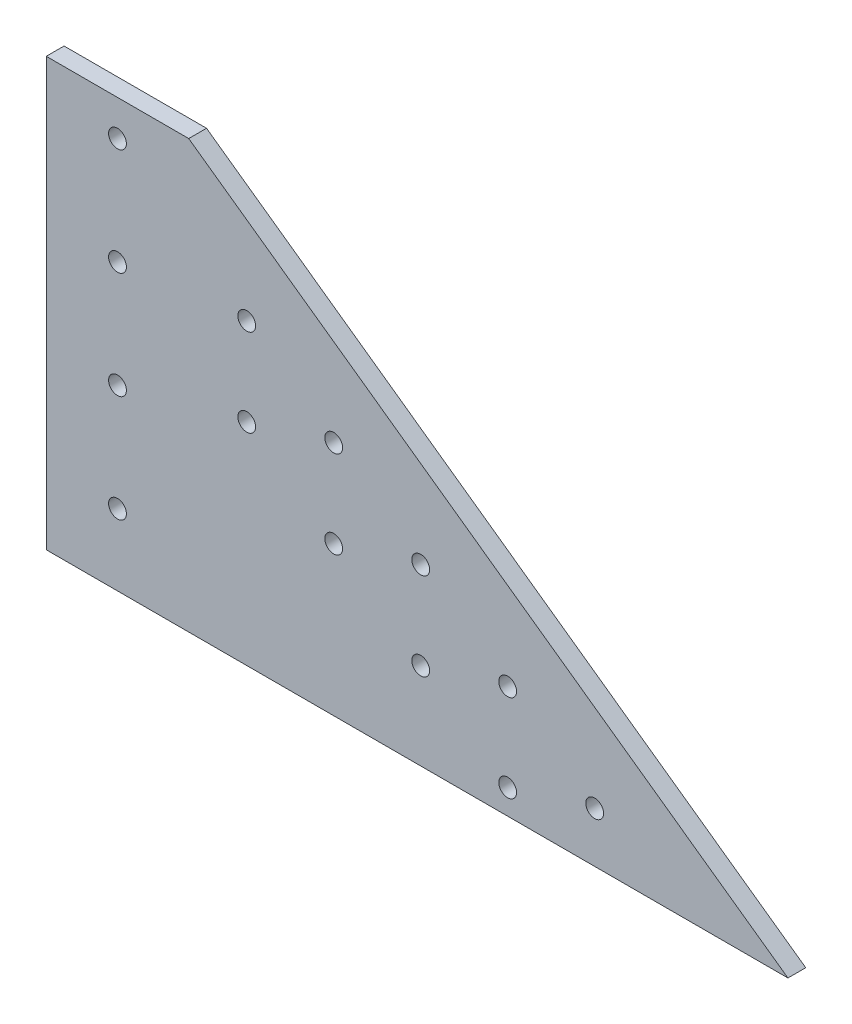
from build123d import *

# Parameters (mm, degrees)
BOSS_EXTRUDE1_DEPTH = 3.175
CUT_EXTRUDE1_REACH  = 154.646
SKETCH2_R           = 1.5875


with BuildPart() as part:
    # Sketch1 → Boss-Extrude1 (new body)
    with BuildSketch(Plane.XY):
        Polygon((0, 0), (25.4, 0), (132.228460039, -76.2), (0, -76.2), align=None)
    extrude(amount=BOSS_EXTRUDE1_DEPTH)

    # Sketch2 → Cut-Extrude1 (cut, up to next)
    with BuildSketch(Plane.XY.offset(3.175), mode=Mode.PRIVATE) as cut_extrude1_sk1:
        with Locations((12.7, -6.35)):
            Circle(SKETCH2_R)
    cut_extrude1_tool1 = extrude(cut_extrude1_sk1.sketch, amount=-CUT_EXTRUDE1_REACH, mode=Mode.PRIVATE) & part.part
    # Sketch2 → Cut-Extrude1 (cut, up to next)
    with BuildSketch(Plane.XY.offset(3.175), mode=Mode.PRIVATE) as cut_extrude1_sk2:
        with Locations((12.7, -25.4)):
            Circle(SKETCH2_R)
    cut_extrude1_tool2 = extrude(cut_extrude1_sk2.sketch, amount=-CUT_EXTRUDE1_REACH, mode=Mode.PRIVATE) & part.part
    # Sketch2 → Cut-Extrude1 (cut, up to next)
    with BuildSketch(Plane.XY.offset(3.175), mode=Mode.PRIVATE) as cut_extrude1_sk3:
        with Locations((12.7, -44.45)):
            Circle(SKETCH2_R)
    cut_extrude1_tool3 = extrude(cut_extrude1_sk3.sketch, amount=-CUT_EXTRUDE1_REACH, mode=Mode.PRIVATE) & part.part
    # Sketch2 → Cut-Extrude1 (cut, up to next)
    with BuildSketch(Plane.XY.offset(3.175), mode=Mode.PRIVATE) as cut_extrude1_sk4:
        with Locations((12.7, -63.5)):
            Circle(SKETCH2_R)
    cut_extrude1_tool4 = extrude(cut_extrude1_sk4.sketch, amount=-CUT_EXTRUDE1_REACH, mode=Mode.PRIVATE) & part.part
    # Sketch2 → Cut-Extrude1 (cut, up to next)
    with BuildSketch(Plane.XY.offset(3.175), mode=Mode.PRIVATE) as cut_extrude1_sk5:
        with Locations((35.739267083, -22.974679309)):
            Circle(SKETCH2_R)
    cut_extrude1_tool5 = extrude(cut_extrude1_sk5.sketch, amount=-CUT_EXTRUDE1_REACH, mode=Mode.PRIVATE) & part.part
    # Sketch2 → Cut-Extrude1 (cut, up to next)
    with BuildSketch(Plane.XY.offset(3.175), mode=Mode.PRIVATE) as cut_extrude1_sk6:
        with Locations((51.248167708, -34.037070616)):
            Circle(SKETCH2_R)
    cut_extrude1_tool6 = extrude(cut_extrude1_sk6.sketch, amount=-CUT_EXTRUDE1_REACH, mode=Mode.PRIVATE) & part.part
    # Sketch2 → Cut-Extrude1 (cut, up to next)
    with BuildSketch(Plane.XY.offset(3.175), mode=Mode.PRIVATE) as cut_extrude1_sk7:
        with Locations((66.757068333, -45.099461922)):
            Circle(SKETCH2_R)
    cut_extrude1_tool7 = extrude(cut_extrude1_sk7.sketch, amount=-CUT_EXTRUDE1_REACH, mode=Mode.PRIVATE) & part.part
    # Sketch2 → Cut-Extrude1 (cut, up to next)
    with BuildSketch(Plane.XY.offset(3.175), mode=Mode.PRIVATE) as cut_extrude1_sk8:
        with Locations((82.265968957, -56.161853228)):
            Circle(SKETCH2_R)
    cut_extrude1_tool8 = extrude(cut_extrude1_sk8.sketch, amount=-CUT_EXTRUDE1_REACH, mode=Mode.PRIVATE) & part.part
    # Sketch2 → Cut-Extrude1 (cut, up to next)
    with BuildSketch(Plane.XY.offset(3.175), mode=Mode.PRIVATE) as cut_extrude1_sk9:
        with Locations((97.774869582, -67.224244535)):
            Circle(SKETCH2_R)
    cut_extrude1_tool9 = extrude(cut_extrude1_sk9.sketch, amount=-CUT_EXTRUDE1_REACH, mode=Mode.PRIVATE) & part.part
    # Sketch2 → Cut-Extrude1 (cut, up to next)
    with BuildSketch(Plane.XY.offset(3.175), mode=Mode.PRIVATE) as cut_extrude1_sk10:
        with Locations((35.739267083, -38.574431081)):
            Circle(SKETCH2_R)
    cut_extrude1_tool10 = extrude(cut_extrude1_sk10.sketch, amount=-CUT_EXTRUDE1_REACH, mode=Mode.PRIVATE) & part.part
    # Sketch2 → Cut-Extrude1 (cut, up to next)
    with BuildSketch(Plane.XY.offset(3.175), mode=Mode.PRIVATE) as cut_extrude1_sk11:
        with Locations((51.248167708, -49.636822388)):
            Circle(SKETCH2_R)
    cut_extrude1_tool11 = extrude(cut_extrude1_sk11.sketch, amount=-CUT_EXTRUDE1_REACH, mode=Mode.PRIVATE) & part.part
    # Sketch2 → Cut-Extrude1 (cut, up to next)
    with BuildSketch(Plane.XY.offset(3.175), mode=Mode.PRIVATE) as cut_extrude1_sk12:
        with Locations((66.757068333, -60.699213694)):
            Circle(SKETCH2_R)
    cut_extrude1_tool12 = extrude(cut_extrude1_sk12.sketch, amount=-CUT_EXTRUDE1_REACH, mode=Mode.PRIVATE) & part.part
    # Sketch2 → Cut-Extrude1 (cut, up to next)
    with BuildSketch(Plane.XY.offset(3.175), mode=Mode.PRIVATE) as cut_extrude1_sk13:
        with Locations((82.265968957, -71.761605)):
            Circle(SKETCH2_R)
    cut_extrude1_tool13 = extrude(cut_extrude1_sk13.sketch, amount=-CUT_EXTRUDE1_REACH, mode=Mode.PRIVATE) & part.part
    add(cut_extrude1_tool1.solids().sort_by_distance((12.7, -6.35, 3.175))[0], mode=Mode.SUBTRACT)
    add(cut_extrude1_tool2.solids().sort_by_distance((12.7, -25.4, 3.175))[0], mode=Mode.SUBTRACT)
    add(cut_extrude1_tool3.solids().sort_by_distance((12.7, -44.45, 3.175))[0], mode=Mode.SUBTRACT)
    add(cut_extrude1_tool4.solids().sort_by_distance((12.7, -63.5, 3.175))[0], mode=Mode.SUBTRACT)
    add(cut_extrude1_tool5.solids().sort_by_distance((35.739267, -22.974679, 3.175))[0], mode=Mode.SUBTRACT)
    add(cut_extrude1_tool6.solids().sort_by_distance((51.248168, -34.037071, 3.175))[0], mode=Mode.SUBTRACT)
    add(cut_extrude1_tool7.solids().sort_by_distance((66.757068, -45.099462, 3.175))[0], mode=Mode.SUBTRACT)
    add(cut_extrude1_tool8.solids().sort_by_distance((82.265969, -56.161853, 3.175))[0], mode=Mode.SUBTRACT)
    add(cut_extrude1_tool9.solids().sort_by_distance((97.77487, -67.224245, 3.175))[0], mode=Mode.SUBTRACT)
    add(cut_extrude1_tool10.solids().sort_by_distance((35.739267, -38.574431, 3.175))[0], mode=Mode.SUBTRACT)
    add(cut_extrude1_tool11.solids().sort_by_distance((51.248168, -49.636822, 3.175))[0], mode=Mode.SUBTRACT)
    add(cut_extrude1_tool12.solids().sort_by_distance((66.757068, -60.699214, 3.175))[0], mode=Mode.SUBTRACT)
    add(cut_extrude1_tool13.solids().sort_by_distance((82.265969, -71.761605, 3.175))[0], mode=Mode.SUBTRACT)


solid = part.part
